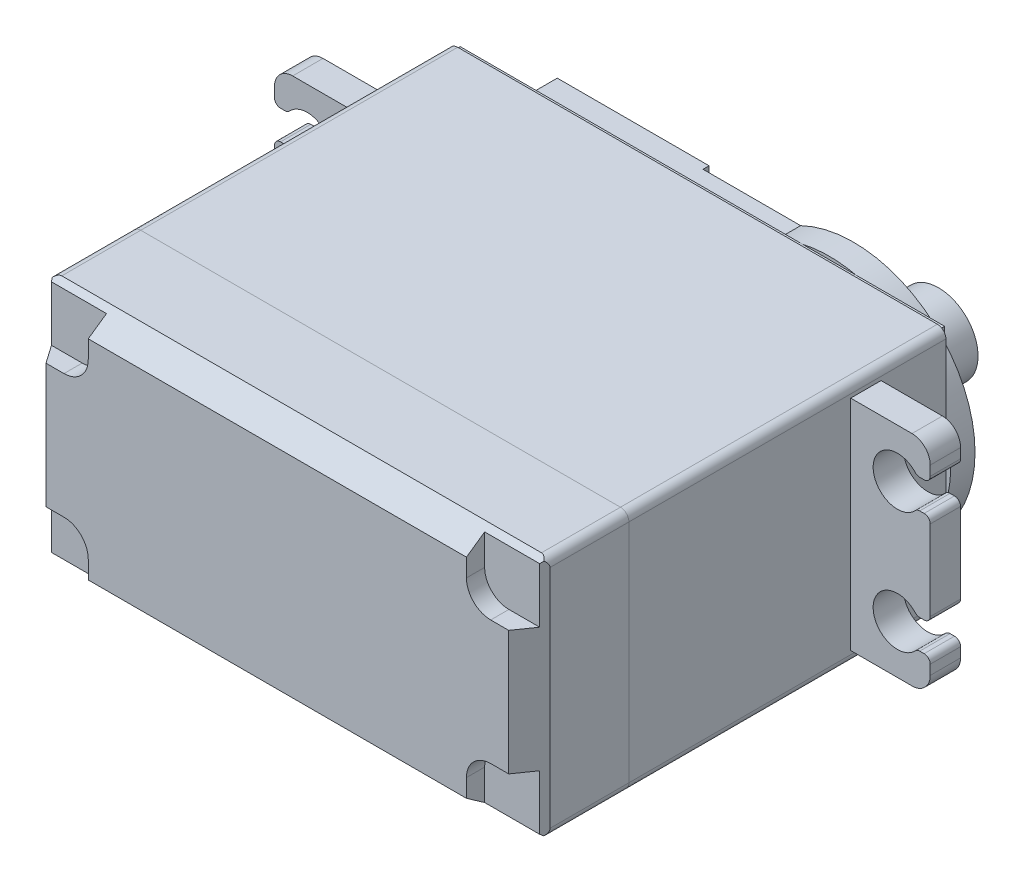
from build123d import *
from OCP.BRepFilletAPI import BRepFilletAPI_MakeChamfer

# Parameters (mm, degrees)
SKETCH1_W            = 40.9
SKETCH1_H            = 20
BOSS_EXTRUDE3_DEPTH  = 19.3
SKETCH4_W            = 40.9
SKETCH4_H            = 20
BOSS_EXTRUDE4_DEPTH  = 6.8
SKETCH6_W            = 40.9
SKETCH6_H            = 20
BOSS_EXTRUDE6_DEPTH  = 8.5
CHAMFER1_SIZE        = 2
CHAMFER1_SIZE2       = 1.400415076
CUT_EXTRUDE1_DEPTH   = 1.5
SKETCH8_W            = 39.9
SKETCH8_H            = 19.5
BOSS_EXTRUDE7_DEPTH  = 0.4
BOSS_EXTRUDE8_DEPTH  = 2
SKETCH10_R           = 6.5
BOSS_EXTRUDE9_DEPTH  = 1.5
SKETCH11_R           = 5.5
BOSS_EXTRUDE10_DEPTH = 0.5
SKETCH12_R           = 3.25
BOSS_EXTRUDE11_DEPTH = 5
SKETCH13_W           = 10.5
SKETCH13_H           = 15.998933302
BOSS_EXTRUDE12_DEPTH = 0.5
FILLET1_R            = 0.7
FILLET6_R            = 0.7
FILLET7_R            = 0.7
BOSS_EXTRUDE13_START = -5.74
BOSS_EXTRUDE13_DEPTH = 2.5


with BuildPart() as part:
    # Sketch1 → Boss-Extrude3 (new body)
    with BuildSketch(Plane.XY):
        Rectangle(SKETCH1_W, SKETCH1_H)
    extrude(amount=BOSS_EXTRUDE3_DEPTH)

    # Fillet1
    fillet1_edges = [part.edges().sort_by_distance(p)[0] for p in [
        (20.45, -10, 9.65),
        (-20.45, -10, 9.65),
        (-20.45, 10, 9.65),
        (20.45, 10, 9.65),
    ]]
    fillet(fillet1_edges, radius=FILLET1_R)



with BuildPart() as body_2:
    # Sketch4 → Boss-Extrude4 (new body)
    with BuildSketch(Plane(origin=(0, 0, 0), x_dir=(-1, 0, 0), z_dir=(0, 0, -1))):
        Rectangle(SKETCH4_W, SKETCH4_H)
    extrude(amount=BOSS_EXTRUDE4_DEPTH)

    # Sketch8 → Boss-Extrude7 (add)
    with BuildSketch(Plane(origin=(0, 0, -6.8), x_dir=(-1, 0, 0), z_dir=(0, 0, -1))):
        Rectangle(SKETCH8_W, SKETCH8_H)
    extrude(amount=BOSS_EXTRUDE7_DEPTH)

    # Sketch9 → Boss-Extrude8 (add)
    with BuildSketch(Plane(origin=(0, 0, -7.2), x_dir=(-1, 0, 0), z_dir=(0, 0, -1))):
        with BuildLine():
            Line((-6.09, 8.999466651), (14.45, 8.999466651))
            Line((14.45, 8.999466651), (14.45, 3))
            ThreePointArc((14.45, 3), (17.45, 0), (14.45, -3))
            Line((14.45, -3), (14.45, -8.999466651))
            Line((14.45, -8.999466651), (-6.09, -8.999466651))
            ThreePointArc((-6.09, -8.999466651), (-20.45, 0), (-6.09, 8.999466651))
        make_face()
    extrude(amount=BOSS_EXTRUDE8_DEPTH)

    # Sketch10 → Boss-Extrude9 (add)
    with BuildSketch(Plane(origin=(0, 0, -9.2), x_dir=(-1, 0, 0), z_dir=(0, 0, -1))):
        with Locations((-10.45, 0)):
            Circle(SKETCH10_R)
    extrude(amount=BOSS_EXTRUDE9_DEPTH)

    # Sketch11 → Boss-Extrude10 (add)
    with BuildSketch(Plane(origin=(0, 0, -10.7), x_dir=(-1, 0, 0), z_dir=(0, 0, -1))):
        with Locations((-10.45, 0)):
            Circle(SKETCH11_R)
    extrude(amount=BOSS_EXTRUDE10_DEPTH)

    # Sketch12 → Boss-Extrude11 (add)
    with BuildSketch(Plane(origin=(0, 0, -11.2), x_dir=(-1, 0, 0), z_dir=(0, 0, -1))):
        with Locations((-10.45, 0)):
            Circle(SKETCH12_R)
    extrude(amount=BOSS_EXTRUDE11_DEPTH)

    # Sketch13 → Boss-Extrude12 (add)
    with BuildSketch(Plane(origin=(0, 0, -9.2), x_dir=(-1, 0, 0), z_dir=(0, 0, -1))):
        with BuildLine():
            Line((14.45, 8.999466651), (1.95, 8.999466651))
            Line((1.95, 8.999466651), (1.95, 1.75))
            ThreePointArc((1.95, 1.75), (0.2, 0), (1.95, -1.75))
            Line((1.95, -1.75), (1.95, -8.999466651))
            Line((1.95, -8.999466651), (14.45, -8.999466651))
            Line((14.45, -8.999466651), (14.45, 8.999466651))
        make_face()
        with Locations((8.2, 0)):
            Rectangle(SKETCH13_W, SKETCH13_H, mode=Mode.SUBTRACT)
    extrude(amount=BOSS_EXTRUDE12_DEPTH)

    # Fillet6
    fillet6_edges = [body_2.edges().sort_by_distance(p)[0] for p in [
        (-20.45, 10, -3.4),
        (-20.45, -10, -3.4),
        (20.45, -10, -3.4),
        (20.45, 10, -3.4),
    ]]
    fillet(fillet6_edges, radius=FILLET6_R)


with BuildPart() as body_3:
    # Sketch6 → Boss-Extrude6 (new body)
    with BuildSketch(Plane.XY.offset(19.3)):
        Rectangle(SKETCH6_W, SKETCH6_H)
    extrude(amount=BOSS_EXTRUDE6_DEPTH)

    # Chamfer1: one chamfer whose edges measure the first distance from different faces: ONE call of the kernel's chamfer builder (chamfer() names one face for all edges)
    chamfer1_edges_1 = [body_3.edges().sort_by_distance(p)[0] for p in [
        (0, 10, 27.8),
    ]]
    chamfer1_side_1 = [body_3.faces().sort_by_distance(p)[0] for p in [
        (0, 10, 23.55),
    ]]
    chamfer1_edges_2 = [body_3.edges().sort_by_distance(p)[0] for p in [
        (-20.45, 0, 27.8),
    ]]
    chamfer1_side_2 = [body_3.faces().sort_by_distance(p)[0] for p in [
        (-20.45, 0, 23.55),
    ]]
    chamfer1_edges_3 = [body_3.edges().sort_by_distance(p)[0] for p in [
        (0, -10, 27.8),
    ]]
    chamfer1_side_3 = [body_3.faces().sort_by_distance(p)[0] for p in [
        (0, -10, 23.55),
    ]]
    chamfer1_edges_4 = [body_3.edges().sort_by_distance(p)[0] for p in [
        (20.45, 0, 27.8),
    ]]
    chamfer1_side_4 = [body_3.faces().sort_by_distance(p)[0] for p in [
        (20.45, 0, 23.55),
    ]]
    chamfer1 = BRepFilletAPI_MakeChamfer(body_3.part.solid().wrapped)
    for e in chamfer1_edges_1:
        chamfer1.Add(CHAMFER1_SIZE, CHAMFER1_SIZE2, e.wrapped, chamfer1_side_1[0].wrapped)  # the first distance lies on this face
    for e in chamfer1_edges_2:
        chamfer1.Add(CHAMFER1_SIZE, CHAMFER1_SIZE2, e.wrapped, chamfer1_side_2[0].wrapped)  # the first distance lies on this face
    for e in chamfer1_edges_3:
        chamfer1.Add(CHAMFER1_SIZE, CHAMFER1_SIZE2, e.wrapped, chamfer1_side_3[0].wrapped)  # the first distance lies on this face
    for e in chamfer1_edges_4:
        chamfer1.Add(CHAMFER1_SIZE, CHAMFER1_SIZE2, e.wrapped, chamfer1_side_4[0].wrapped)  # the first distance lies on this face
    add(Compound.cast(chamfer1.Shape()), mode=Mode.REPLACE)

    # Sketch7 → Cut-Extrude1 (cut)
    with BuildSketch(Plane.XY.offset(27.8)):
        with BuildLine():
            Line((-20.45, 10), (-15.57, 10))
            Line((-15.57, 10), (-15.57, 7.12))
            ThreePointArc((-15.57, 7.12), (-16.155786438, 5.705786438), (-17.57, 5.12))
            Line((-17.57, 5.12), (-20.45, 5.12))
            Line((-20.45, 5.12), (-20.45, 10))
        make_face()
        with BuildLine():
            Line((20.45, 5.12), (17.57, 5.12))
            ThreePointArc((17.57, 5.12), (16.155786438, 5.705786438), (15.57, 7.12))
            Line((15.57, 7.12), (15.57, 10))
            Line((15.57, 10), (20.45, 10))
            Line((20.45, 10), (20.45, 5.12))
        make_face()
        with BuildLine():
            Line((20.45, -10), (20.45, -5.12))
            Line((20.45, -5.12), (17.57, -5.12))
            ThreePointArc((17.57, -5.12), (16.155786438, -5.705786438), (15.57, -7.12))
            Line((15.57, -7.12), (15.57, -10))
            Line((15.57, -10), (20.45, -10))
        make_face()
        with BuildLine():
            Line((-15.57, -10), (-15.57, -7.12))
            ThreePointArc((-15.57, -7.12), (-16.155786438, -5.705786438), (-17.57, -5.12))
            Line((-17.57, -5.12), (-20.45, -5.12))
            Line((-20.45, -5.12), (-20.45, -10))
            Line((-20.45, -10), (-15.57, -10))
        make_face()
    extrude(amount=-CUT_EXTRUDE1_DEPTH, mode=Mode.SUBTRACT)

    # Fillet7
    fillet7_edges = [body_3.edges().sort_by_distance(p)[0] for p in [
        (-20.45, -10, 22.55),
        (-20.45, 10, 22.55),
        (20.45, 10, 22.55),
        (20.45, -10, 22.55),
    ]]
    fillet(fillet7_edges, radius=FILLET7_R)


with BuildPart() as part_1:
    add(part.part)

    add(body_2.part)  # Boss-Extrude13 merges body 2
    # Sketch16 → Boss-Extrude13 (add)
    with BuildSketch(Plane(origin=(0, 0, -7.2), x_dir=(-1, 0, 0), z_dir=(0, 0, -1)).offset(BOSS_EXTRUDE13_START)):
        with BuildLine():
            Line((20.45, 9), (25.5, 9))
            ThreePointArc((25.5, 9), (26.560660172, 8.560660172), (27, 7.5))
            Line((27, 7.5), (27, 6.7))
            ThreePointArc((27, 6.7), (26.853553391, 6.346446609), (26.5, 6.2))
            Line((26.5, 6.2), (26.133030278, 6.2))
            ThreePointArc((26.133030278, 6.2), (25.933030278, 6.241742431), (25.766424222, 6.36))
            ThreePointArc((25.766424222, 6.36), (22.3, 5), (25.766424222, 3.64))
            ThreePointArc((25.766424222, 3.64), (25.933030278, 3.758257569), (26.133030278, 3.8))
            Line((26.133030278, 3.8), (26.5, 3.8))
            ThreePointArc((26.5, 3.8), (26.853553391, 3.653553391), (27, 3.3))
            Line((27, 3.3), (27, -3.3))
            ThreePointArc((27, -3.3), (26.853553391, -3.653553391), (26.5, -3.8))
            Line((26.5, -3.8), (26.133030278, -3.8))
            ThreePointArc((26.133030278, -3.8), (25.933030278, -3.758257569), (25.766424222, -3.64))
            ThreePointArc((25.766424222, -3.64), (22.3, -5), (25.766424222, -6.36))
            ThreePointArc((25.766424222, -6.36), (25.933030278, -6.241742431), (26.133030278, -6.2))
            Line((26.133030278, -6.2), (26.5, -6.2))
            ThreePointArc((26.5, -6.2), (26.853553391, -6.346446609), (27, -6.7))
            Line((27, -6.7), (27, -7.5))
            ThreePointArc((27, -7.5), (26.560660172, -8.560660172), (25.5, -9))
            Line((25.5, -9), (20.45, -9))
            Line((20.45, -9), (20.45, 9))
        make_face()
    boss_extrude13 = extrude(amount=-BOSS_EXTRUDE13_DEPTH)

    # Mirror1: Boss-Extrude13 across plane
    add(boss_extrude13.mirror(Plane(origin=(0, 0, 0), x_dir=(0, 0, 1), z_dir=(1, 0, 0))))


solid = Compound([body_3.part, part_1.part])
